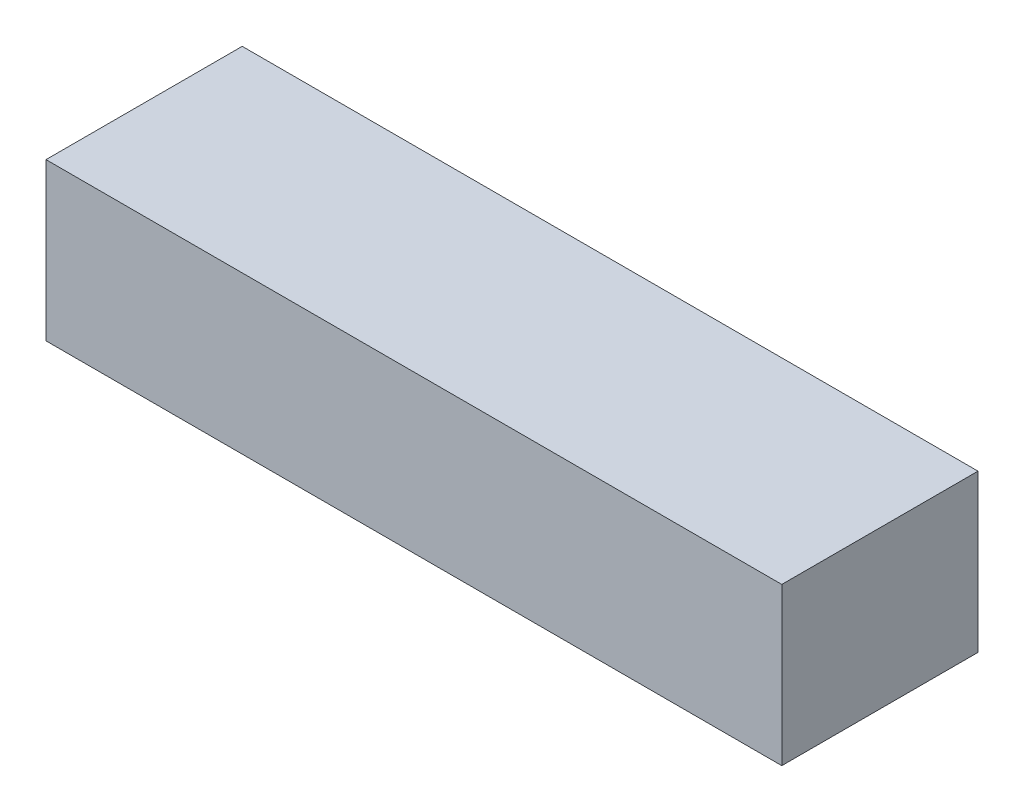
from build123d import *

# Parameters (mm, degrees)
SKETCH1_W           = 150
SKETCH1_H           = 40
BOSS_EXTRUDE1_DEPTH = 30
SHELL3_T            = -2
SKETCH3_W           = 20
SKETCH3_H           = 20
CUT_EXTRUDE1_DEPTH  = 5
SKETCH6_W           = 19.798687527
SKETCH6_H           = 12.601964569
BOSS_EXTRUDE3_DEPTH = 24
SKETCH7_W           = 150
SKETCH7_H           = 40
BOSS_EXTRUDE4_DEPTH = 2
SKETCH8_R           = 1.5
BOSS_EXTRUDE5_DEPTH = 5
SKETCH9_R           = 1.5
BOSS_EXTRUDE6_DEPTH = 5


with BuildPart() as part:
    # Sketch1 → Boss-Extrude1 (new body)
    with BuildSketch(Plane(origin=(0, 0, 0), x_dir=(1, 0, 0), z_dir=(0, 1, 0))):
        Rectangle(SKETCH1_W, SKETCH1_H)
    extrude(amount=BOSS_EXTRUDE1_DEPTH)

    # Shell3
    shell3_openings = [part.faces().sort_by_distance(p)[0] for p in [
        (0, 30, 0),
    ]]
    offset(amount=SHELL3_T, openings=shell3_openings, kind=Kind.INTERSECTION)

    # Sketch3 → Cut-Extrude1 (cut)
    with BuildSketch(Plane(origin=(0, 0, -20), x_dir=(-1, 0, 0), z_dir=(0, 0, -1))):
        with Locations((4.963499303, 15)):
            Rectangle(SKETCH3_W, SKETCH3_H)
    extrude(amount=-CUT_EXTRUDE1_DEPTH, mode=Mode.SUBTRACT)

    # Sketch6 → Boss-Extrude3 (add)
    with BuildSketch(Plane(origin=(0, 2, 0), x_dir=(1, 0, 0), z_dir=(0, 1, 0))):
        with Locations((-4.895398538, 11.699017716)):
            Rectangle(SKETCH6_W, SKETCH6_H)
    extrude(amount=BOSS_EXTRUDE3_DEPTH)

    # Sketch7 → Boss-Extrude4 (add)
    with BuildSketch(Plane(origin=(0, 30, 0), x_dir=(1, 0, 0), z_dir=(0, 1, 0))):
        Rectangle(SKETCH7_W, SKETCH7_H)
    extrude(amount=BOSS_EXTRUDE4_DEPTH)

    # Sketch8 → Boss-Extrude5 (add)
    with BuildSketch(Plane(origin=(0, 0, -20), x_dir=(-1, 0, 0), z_dir=(0, 0, -1))):
        with Locations(Location((-46.510205531, 16.504268765, 0), (0, 0, 180))):
            Circle(SKETCH8_R)
    extrude(amount=BOSS_EXTRUDE5_DEPTH)

    # Sketch9 → Boss-Extrude6 (add)
    with BuildSketch(Plane(origin=(0, 0, -20), x_dir=(-1, 0, 0), z_dir=(0, 0, -1))):
        with Locations(Location((47, 17.020870221, 0), (0, 0, 180))):
            Circle(SKETCH9_R)
    extrude(amount=BOSS_EXTRUDE6_DEPTH)


solid = part.part
